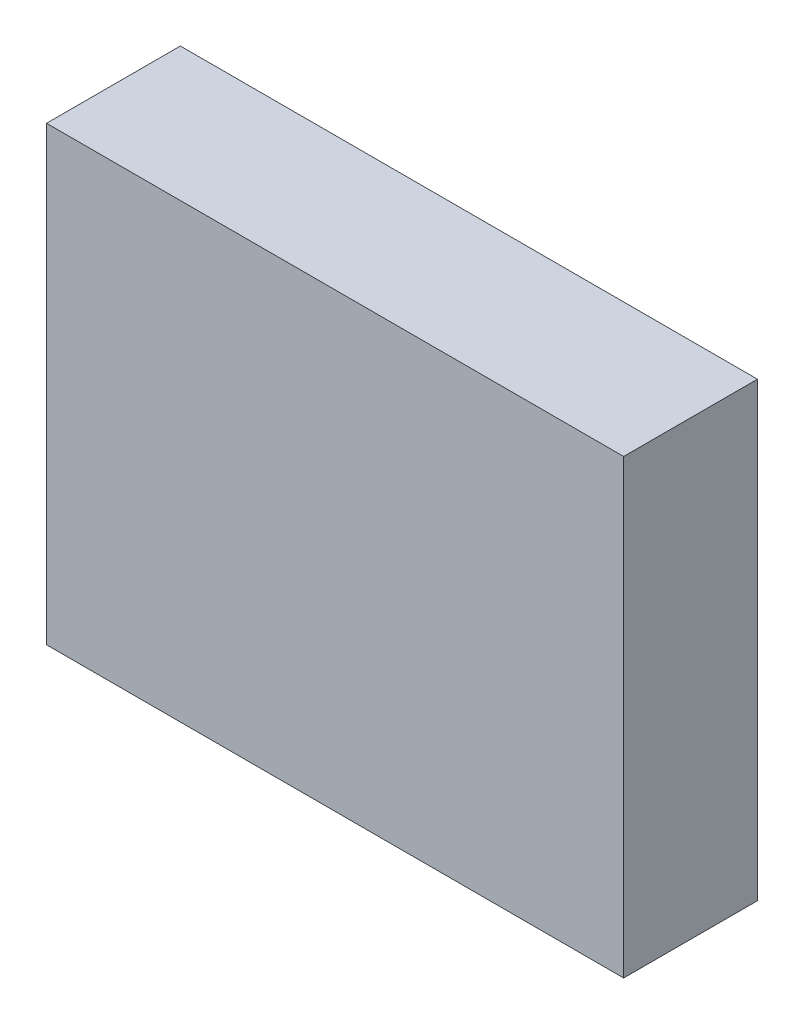
from build123d import *

# Parameters (mm, degrees)
SKETCH1_W     = 69
SKETCH1_H     = 54
PROFILE_DEPTH = 16


with BuildPart() as part:
    # Sketch1 → Profile (new body)
    with BuildSketch(Plane.XY):
        with Locations((34.5, 27)):
            Rectangle(SKETCH1_W, SKETCH1_H)
    extrude(amount=PROFILE_DEPTH)


solid = part.part
